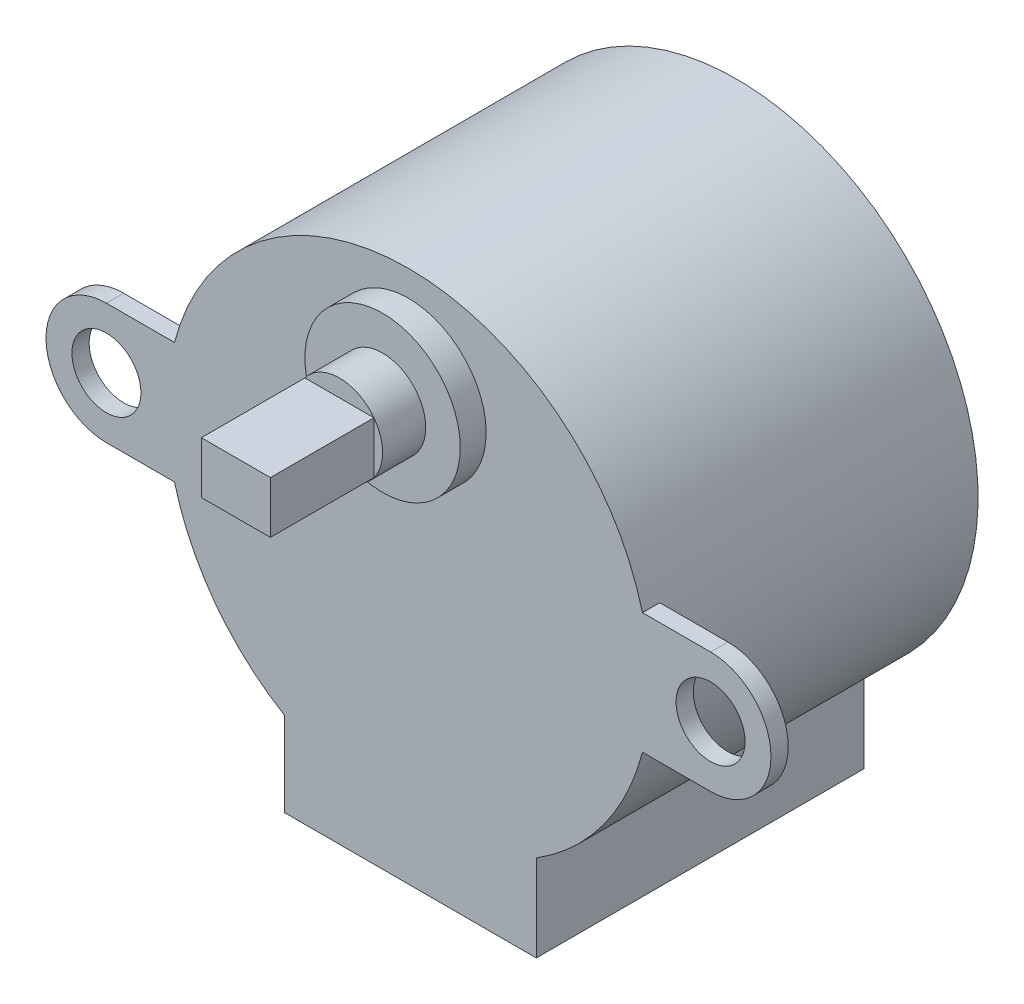
from build123d import *

# Parameters (mm, degrees)
ESBO_O2_R                = 14
RESSALTO_EXTRUS_O2_DEPTH = 19
ESBO_O3_W                = 14.6
ESBO_O3_H                = 5
RESSALTO_EXTRUS_O3_DEPTH = 19
ESBO_O4_W                = 10
ESBO_O4_H                = 7
RESSALTO_EXTRUS_O4_DEPTH = 19
RESSALTO_EXTRUS_O5_DEPTH = 19
ESBO_O6_R                = 2
CORTE_EXTRUS_O1_DEPTH    = 35.551542095
CORTE_EXTRUS_O2_DEPTH    = 35.551542095
CORTE_EXTRUS_O3_DEPTH    = 35.551542095
ESBO_O9_R                = 4.5
RESSALTO_EXTRUS_O7_DEPTH = 20.5
ESBO_O10_R               = 2.5
RESSALTO_EXTRUS_O8_DEPTH = 2.5
ESBO_O11_W               = 4
ESBO_O11_H               = 3
RESSALTO_EXTRUS_O9_DEPTH = 29
CORTE_EXTRUS_O4_DEPTH    = 18
CORTE_EXTRUS_O5_DEPTH    = 18


with BuildPart() as part:
    # Esboço2 → Ressalto-extrusão2 (new body)
    with BuildSketch(Plane.XY):
        Circle(ESBO_O2_R)
    extrude(amount=RESSALTO_EXTRUS_O2_DEPTH)

    # Esboço3 → Ressalto-extrusão3 (add)
    with BuildSketch(Plane.XY.offset(19)):
        with Locations((0.104281732, -14.40160663)):
            Rectangle(ESBO_O3_W, ESBO_O3_H)
    extrude(amount=-RESSALTO_EXTRUS_O3_DEPTH)

    # Esboço4 → Ressalto-extrusão4 (add)
    with BuildSketch(Plane.XY.offset(19)):
        with Locations((18.39112555, 0)):
            Rectangle(ESBO_O4_W, ESBO_O4_H)
    extrude(amount=-RESSALTO_EXTRUS_O4_DEPTH)

    # Esboço5 → Ressalto-extrusão5 (add)
    with BuildSketch(Plane.XY.offset(19)):
        Polygon((-13.354036811, 3.5), (-23.354036811, 3.5), (-23.354036811, -3.5), (-13.354036811, -3.5), (-13.354036811, 0), align=None)
    extrude(amount=-RESSALTO_EXTRUS_O5_DEPTH)

    # Esboço6 → Corte-extrusão1 (cut, through all)
    with BuildSketch(Plane.XY.offset(19)):
        with Locations((-17.5, 0)):
            Circle(ESBO_O6_R)
        with Locations((17.5, 0)):
            Circle(ESBO_O6_R)
    extrude(amount=-CORTE_EXTRUS_O1_DEPTH, mode=Mode.SUBTRACT)

    # Esboço7 → Corte-extrusão2 (cut, through all)
    with BuildSketch(Plane.XY):
        with BuildLine():
            Line((-17.5, 3.5), (-23.354036811, 3.5))
            Line((-23.354036811, 3.5), (-23.354036811, -3.5))
            Line((-23.354036811, -3.5), (-17.5, -3.5))
            ThreePointArc((-17.5, -3.5), (-21, 0), (-17.5, 3.5))
        make_face()
    extrude(amount=CORTE_EXTRUS_O2_DEPTH, mode=Mode.SUBTRACT)

    # Esboço8 → Corte-extrusão3 (cut, through all)
    with BuildSketch(Plane.XY):
        with BuildLine():
            Line((17.5, 3.5), (23.39112555, 3.5))
            Line((23.39112555, 3.5), (23.39112555, -3.5))
            Line((23.39112555, -3.5), (17.5, -3.5))
            ThreePointArc((17.5, -3.5), (21, 0), (17.5, 3.5))
        make_face()
    extrude(amount=CORTE_EXTRUS_O3_DEPTH, mode=Mode.SUBTRACT)

    # Esboço9 → Ressalto-extrusão7 (add)
    with BuildSketch(Plane.XY):
        with Locations((0, 8)):
            Circle(ESBO_O9_R)
    extrude(amount=RESSALTO_EXTRUS_O7_DEPTH)

    # Esboço10 → Ressalto-extrusão8 (add)
    with BuildSketch(Plane.XY.offset(20.5)):
        with Locations((0, 8)):
            Circle(ESBO_O10_R)
    extrude(amount=RESSALTO_EXTRUS_O8_DEPTH)

    # Esboço11 → Ressalto-extrusão9 (add)
    with BuildSketch(Plane.XY):
        with Locations((0, 8)):
            Rectangle(ESBO_O11_W, ESBO_O11_H)
    extrude(amount=RESSALTO_EXTRUS_O9_DEPTH)

    # Esboço12 → Corte-extrusão4 (cut)
    with BuildSketch(Plane(origin=(0, 0, 0), x_dir=(-1, 0, 0), z_dir=(0, 0, -1))):
        with BuildLine():
            Line((-17.5, -3.5), (-13.555441712, -3.5))
            ThreePointArc((-13.555441712, -3.5), (-14, 0), (-13.555441712, 3.5))
            Line((-13.555441712, 3.5), (-17.5, 3.5))
            ThreePointArc((-17.5, 3.5), (-21, 0), (-17.5, -3.5))
        make_face()
    extrude(amount=-CORTE_EXTRUS_O4_DEPTH, mode=Mode.SUBTRACT)

    # Esboço13 → Corte-extrusão5 (cut)
    with BuildSketch(Plane(origin=(0, 0, 0), x_dir=(-1, 0, 0), z_dir=(0, 0, -1))):
        with BuildLine():
            Line((13.555441712, -3.5), (17.5, -3.5))
            ThreePointArc((17.5, -3.5), (21, 0), (17.5, 3.5))
            Line((17.5, 3.5), (13.555441712, 3.5))
            ThreePointArc((13.555441712, 3.5), (14, 0), (13.555441712, -3.5))
        make_face()
    extrude(amount=-CORTE_EXTRUS_O5_DEPTH, mode=Mode.SUBTRACT)


solid = part.part
